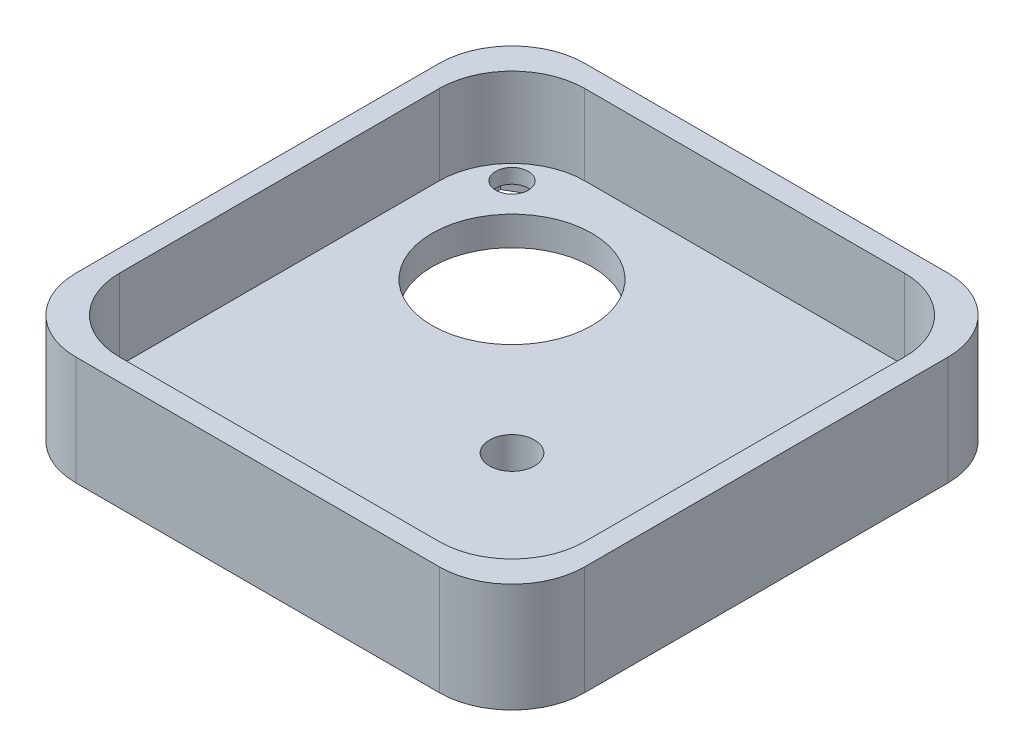
from build123d import *

# Parameters (mm, degrees)
SKETCH1_R           = 2.5
BOSS_EXTRUDE2_DEPTH = 4
BOSS_EXTRUDE3_DEPTH = 11
SKETCH4_R           = 11
CUT_EXTRUDE1_DEPTH  = 6
SKETCH5_R           = 10
BOSS_EXTRUDE5_DEPTH = 10
SKETCH6_W           = 5.8
SKETCH6_H           = 2.8
CUT_EXTRUDE2_DEPTH  = 8.8
SKETCH8_R           = 1.6
CUT_EXTRUDE3_DEPTH  = 10
SKETCH10_R          = 3.1
CUT_EXTRUDE5_DEPTH  = 103.102889283
SKETCH11_R          = 2.25
CUT_EXTRUDE6_DEPTH  = 10
CUT_EXTRUDE7_DEPTH  = 2


with BuildPart() as part:
    # Sketch1 → Boss-Extrude2 (new body)
    with BuildSketch(Plane(origin=(0, 0, 0), x_dir=(1, 0, 0), z_dir=(0, 1, 0))):
        with BuildLine():
            Line((-10, 0), (-60, 0))
            ThreePointArc((-60, 0), (-67.071067812, 2.928932188), (-70, 10))
            Line((-70, 10), (-70, 60))
            ThreePointArc((-70, 60), (-67.071067812, 67.071067812), (-60, 70))
            Line((-60, 70), (-10, 70))
            ThreePointArc((-10, 70), (-2.928932188, 67.071067812), (0, 60))
            Line((0, 60), (0, 10))
            ThreePointArc((0, 10), (-2.928932188, 2.928932188), (-10, 0))
        make_face()
        with Locations(Location((-50.25, 50.25, 0), (0, 0, 270))):
            Circle(SKETCH1_R, mode=Mode.SUBTRACT)
        with Locations(Location((-29.56712665, 29.56712665, 0), (0, 0, 270))):
            Circle(SKETCH1_R, mode=Mode.SUBTRACT)
    extrude(amount=BOSS_EXTRUDE2_DEPTH)

    # Sketch2 → Boss-Extrude3 (add)
    with BuildSketch(Plane(origin=(0, 4, 0), x_dir=(1, 0, 0), z_dir=(0, 1, 0))):
        with BuildLine():
            Line((-10, 0), (-60, 0))
            ThreePointArc((-60, 0), (-67.071067812, 2.928932188), (-70, 10))
            Line((-70, 10), (-70, 60))
            ThreePointArc((-70, 60), (-67.071067812, 67.071067812), (-60, 70))
            Line((-60, 70), (-10, 70))
            ThreePointArc((-10, 70), (-2.928932188, 67.071067812), (0, 60))
            Line((0, 60), (0, 10))
            ThreePointArc((0, 10), (-2.928932188, 2.928932188), (-10, 0))
        make_face()
        with BuildLine():
            Line((-3, 13), (-3, 57))
            ThreePointArc((-3, 57), (-5.928932188, 64.071067812), (-13, 67))
            Line((-13, 67), (-57, 67))
            ThreePointArc((-57, 67), (-64.071067812, 64.071067812), (-67, 57))
            Line((-67, 57), (-67, 13))
            ThreePointArc((-67, 13), (-64.071067812, 5.928932188), (-57, 3))
            Line((-57, 3), (-13, 3))
            ThreePointArc((-13, 3), (-5.928932188, 5.928932188), (-3, 13))
        make_face(mode=Mode.SUBTRACT)
    extrude(amount=BOSS_EXTRUDE3_DEPTH)

    # Sketch4 → Cut-Extrude1 (cut)
    with BuildSketch(Plane(origin=(0, 4, 0), x_dir=(1, 0, 0), z_dir=(0, 1, 0))):
        with Locations(Location((-50.25, 50.25, 0), (0, 0, 270))):
            Circle(SKETCH4_R)
    extrude(amount=-CUT_EXTRUDE1_DEPTH, mode=Mode.SUBTRACT)

    # Sketch5 → Boss-Extrude5 (add)
    with BuildSketch(Plane.XZ):
        with Locations(Location((-29.56712665, -29.56712665, 0), (0, 0, 90))):
            Circle(SKETCH5_R)
    extrude(amount=BOSS_EXTRUDE5_DEPTH)

    # Sketch6 → Cut-Extrude2 (cut)
    with BuildSketch(Plane.XZ.offset(10)):
        with Locations((-29.56712665, -36.06712665)):
            Rectangle(SKETCH6_W, SKETCH6_H)
    extrude(amount=-CUT_EXTRUDE2_DEPTH, mode=Mode.SUBTRACT)

    # Sketch8 → Cut-Extrude3 (cut)
    with BuildSketch(Plane(origin=(-29.56712665, -10, -39.56712665), x_dir=(-1, 0, 0), z_dir=(0, 0, -1))):
        with Locations((0, 5)):
            Circle(SKETCH8_R)
    extrude(amount=-CUT_EXTRUDE3_DEPTH, mode=Mode.SUBTRACT)

    # Sketch10 → Cut-Extrude5 (cut, through all)
    with BuildSketch(Plane.XZ.offset(10)):
        with Locations(Location((-29.56712665, -29.56712665, 0), (0, 0, 270))):
            Circle(SKETCH10_R)
    extrude(amount=-CUT_EXTRUDE5_DEPTH, mode=Mode.SUBTRACT)

    # Sketch11 → Cut-Extrude6 (cut)
    with BuildSketch(Plane(origin=(0, 4, 0), x_dir=(1, 0, 0), z_dir=(0, 1, 0))):
        with Locations(Location((-8, 62, 0), (0, 0, 270))):
            Circle(SKETCH11_R)
        with Locations(Location((-62, 62, 0), (0, 0, 270))):
            Circle(SKETCH11_R)
        with Locations(Location((-62, 8, 0), (0, 0, 270))):
            Circle(SKETCH11_R)
        with Locations(Location((-8, 8, 0), (0, 0, 270))):
            Circle(SKETCH11_R)
    extrude(amount=-CUT_EXTRUDE6_DEPTH, mode=Mode.SUBTRACT)

    # Sketch12 → Cut-Extrude7 (cut)
    with BuildSketch(Plane.XZ):
        Polygon((-62, -3.669872981), (-65.75, -5.834936491), (-65.75, -10.165063509), (-62, -12.330127019), (-58.25, -10.165063509), (-58.25, -5.834936491), align=None)
        Polygon((-8, -3.669872981), (-11.75, -5.834936491), (-11.75, -10.165063509), (-8, -12.330127019), (-4.25, -10.165063509), (-4.25, -5.834936491), align=None)
        Polygon((-62, -57.669872981), (-65.75, -59.834936491), (-65.75, -64.165063509), (-62, -66.330127019), (-58.25, -64.165063509), (-58.25, -59.834936491), align=None)
        Polygon((-8, -57.669872981), (-11.75, -59.834936491), (-11.75, -64.165063509), (-8, -66.330127019), (-4.25, -64.165063509), (-4.25, -59.834936491), align=None)
    extrude(amount=-CUT_EXTRUDE7_DEPTH, mode=Mode.SUBTRACT)


solid = part.part
